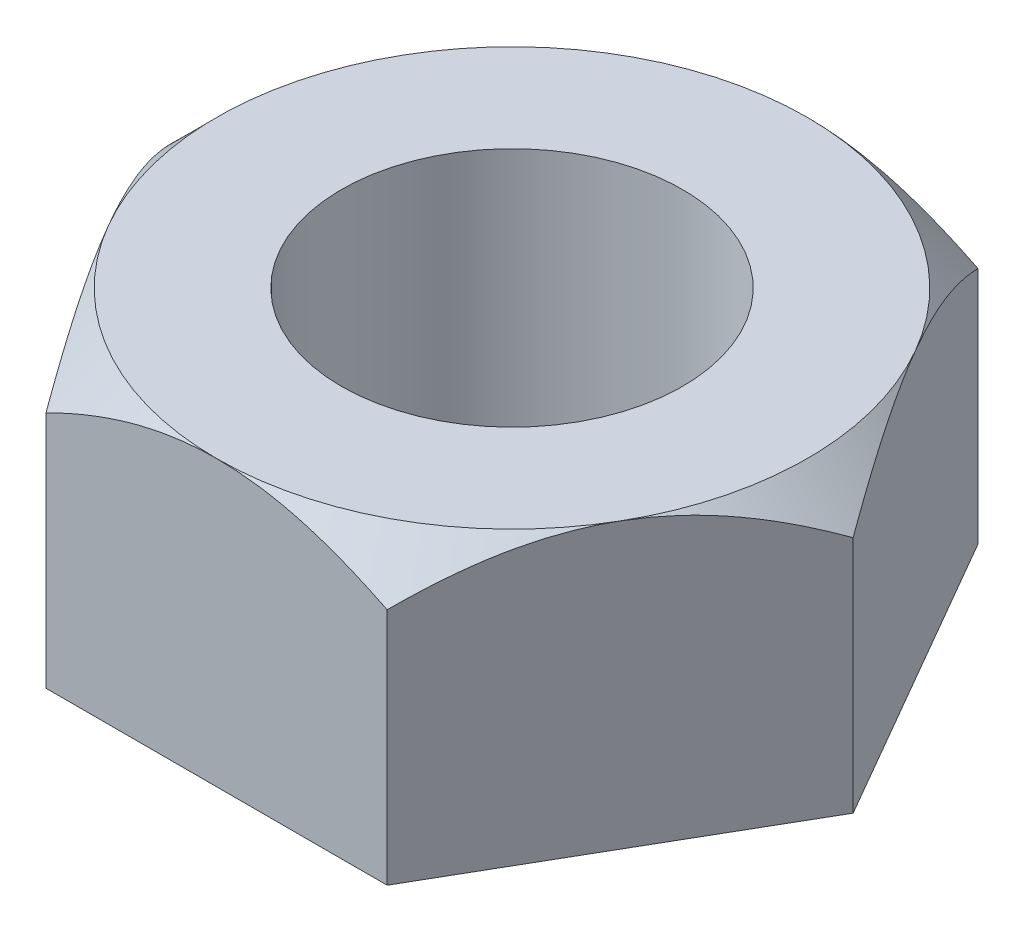
from build123d import *

# Parameters (mm, degrees)
BOSS_EXTRUDE1_DEPTH = 10
SKETCH2_OUTSIDE_W   = 56.658
SKETCH2_OUTSIDE_H   = 53.442
SKETCH2_OUTSIDE_R   = 10.392304845
CUT_EXTRUDE2_DEPTH  = 12
CUT_EXTRUDE2_DRAFT  = -45
CUT_EXTRUDE3_REACH  = 20.762
SKETCH3_R           = 6


with BuildPart() as part:
    # Sketch1 → Boss-Extrude1 (new body)
    with BuildSketch(Plane(origin=(0, 0, 0), x_dir=(1, 0, 0), z_dir=(0, 1, 0))):
        Polygon((6, -10.392304845), (12, 0), (6, 10.392304845), (-6, 10.392304845), (-12, 0), (-6, -10.392304845), align=None)
    extrude(amount=BOSS_EXTRUDE1_DEPTH)


with BuildPart() as cut_extrude2_tool:
    # Sketch2 outside → Cut-Extrude2 (with draft: the straight prism first)
    with BuildSketch(Plane(origin=(0, 10, 0), x_dir=(1, 0, 0), z_dir=(0, 1, 0))):
        Rectangle(SKETCH2_OUTSIDE_W, SKETCH2_OUTSIDE_H)
        Circle(SKETCH2_OUTSIDE_R, mode=Mode.SUBTRACT)
    extrude(amount=-CUT_EXTRUDE2_DEPTH)
    # Cut-Extrude2: the draft: its side faces are tilted about the plane it starts from
    cut_extrude2_sides = [cut_extrude2_tool.faces().sort_by_distance(p)[0] for p in [
        (0, 4, 26.721),
        (28.329, 4, 0),
        (0, 4, -26.721),
        (-28.329, 4, 0),
        (-10.392304845, 4, 0),
    ]]
    draft(cut_extrude2_sides, Plane(origin=(0, 10, 0), x_dir=(1, 0, 0), z_dir=(0, 1, 0)), CUT_EXTRUDE2_DRAFT)


with BuildPart() as part_1:
    add(part.part)

    # Cut-Extrude2: cut by cut_extrude2_tool
    add(cut_extrude2_tool.part, mode=Mode.SUBTRACT)

    # Sketch3 → Cut-Extrude3 (cut, up to next)
    with BuildSketch(Plane(origin=(0, 10, 0), x_dir=(1, 0, 0), z_dir=(0, 1, 0)), mode=Mode.PRIVATE) as cut_extrude3_sk1:
        with Locations(Location((0, 0, 0), (0, 0, 270))):
            Circle(SKETCH3_R)
    cut_extrude3_tool1 = extrude(cut_extrude3_sk1.sketch, amount=-CUT_EXTRUDE3_REACH, mode=Mode.PRIVATE) & part_1.part
    add(cut_extrude3_tool1.solids().sort_by_distance((0, 10, 0))[0], mode=Mode.SUBTRACT)


solid = part_1.part
